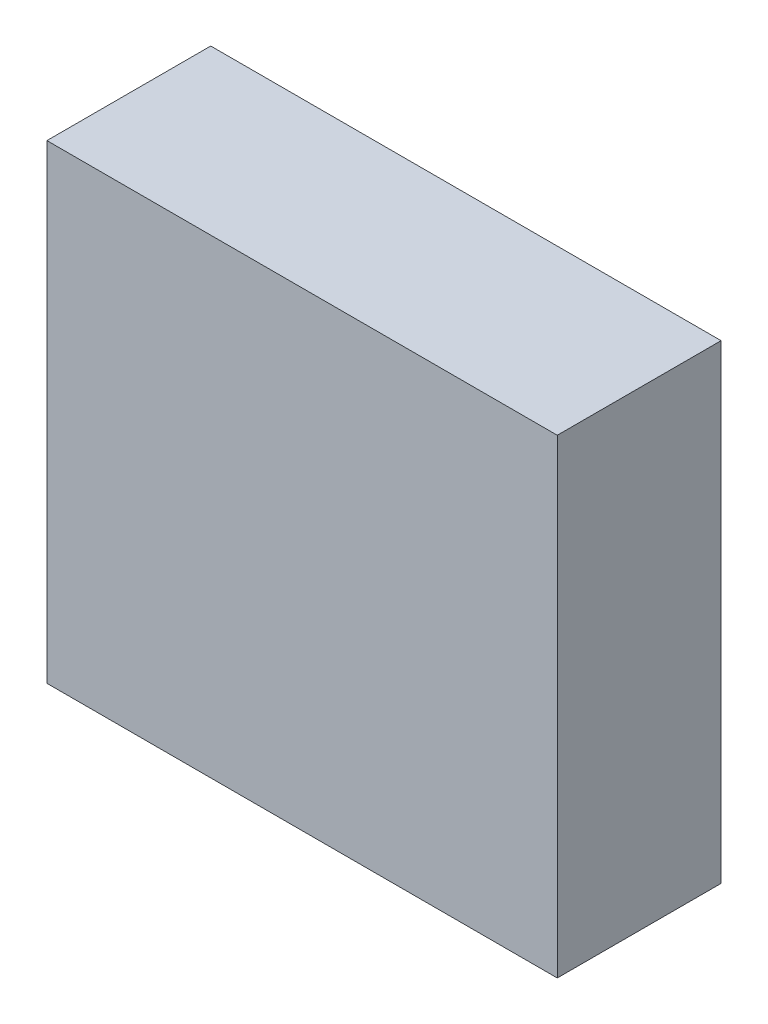
from build123d import *

# Parameters (mm, degrees)
SKETCH_1_W      = 10.25
SKETCH_1_H      = 9.44
EXTRUDE_1_DEPTH = 3.29


with BuildPart() as part:
    # 草图1 → 凸台-拉伸1 (new body)
    with BuildSketch(Plane.XY):
        with Locations((0, -0.755)):
            Rectangle(SKETCH_1_W, SKETCH_1_H)
    extrude(amount=EXTRUDE_1_DEPTH)


solid = part.part
